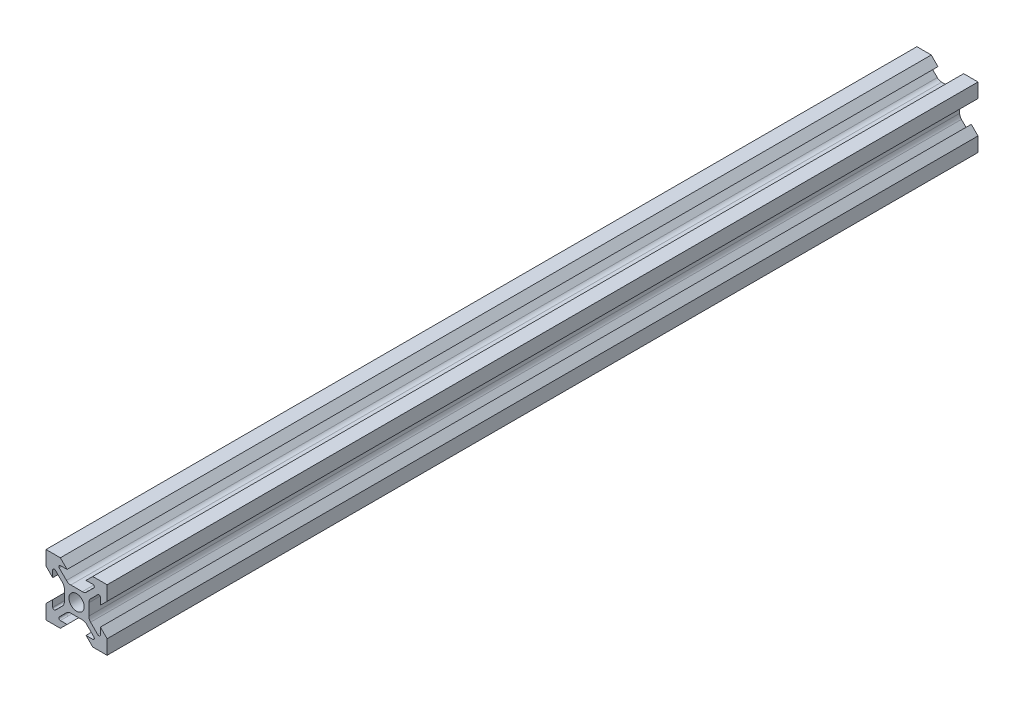
from build123d import *

# Parameters (mm, degrees)
SKETCH1_R           = 2.5
BOSS_EXTRUDE1_DEPTH = 285


with BuildPart() as part:
    # Sketch1 → Boss-Extrude1 (new body)
    with BuildSketch(Plane.XY):
        with BuildLine():
            Line((-10, 10), (-10, 5.3))
            Line((-10, 5.3), (-7.8, 3.1))
            Line((-7.8, 3.1), (-7.8, 5.320101013))
            ThreePointArc((-7.8, 5.320101013), (-7.491341716, 5.782040779), (-6.946446609, 5.673654403))
            Line((-6.946446609, 5.673654403), (-4.585786438, 3.312994231))
            ThreePointArc((-4.585786438, 3.312994231), (-4.152240935, 2.664147534), (-4, 1.898780669))
            Line((-4, 1.898780669), (-4, 0))
            Line((-4, 0), (-4, -1.898780669))
            ThreePointArc((-4, -1.898780669), (-4.152240935, -2.664147534), (-4.585786438, -3.312994231))
            Line((-4.585786438, -3.312994231), (-6.946446609, -5.673654403))
            ThreePointArc((-6.946446609, -5.673654403), (-7.491341716, -5.782040779), (-7.8, -5.320101013))
            Line((-7.8, -5.320101013), (-7.8, -3.1))
            Line((-7.8, -3.1), (-10, -5.3))
            Line((-10, -5.3), (-10, -10))
            Line((-10, -10), (-5.3, -10))
            Line((-5.3, -10), (-3.1, -7.8))
            Line((-3.1, -7.8), (-5.320101013, -7.8))
            ThreePointArc((-5.320101013, -7.8), (-5.782040779, -7.491341716), (-5.673654403, -6.946446609))
            Line((-5.673654403, -6.946446609), (-3.312994231, -4.585786438))
            ThreePointArc((-3.312994231, -4.585786438), (-2.664147534, -4.152240935), (-1.898780669, -4))
            Line((-1.898780669, -4), (0, -4))
            Line((0, -4), (1.898780669, -4))
            ThreePointArc((1.898780669, -4), (2.664147534, -4.152240935), (3.312994231, -4.585786438))
            Line((3.312994231, -4.585786438), (5.673654403, -6.946446609))
            ThreePointArc((5.673654403, -6.946446609), (5.782040779, -7.491341716), (5.320101013, -7.8))
            Line((5.320101013, -7.8), (3.1, -7.8))
            Line((3.1, -7.8), (5.3, -10))
            Line((5.3, -10), (10, -10))
            Line((10, -10), (10, -5.3))
            Line((10, -5.3), (7.8, -3.1))
            Line((7.8, -3.1), (7.8, -5.320101013))
            ThreePointArc((7.8, -5.320101013), (7.491341716, -5.782040779), (6.946446609, -5.673654403))
            Line((6.946446609, -5.673654403), (4.585786438, -3.312994231))
            ThreePointArc((4.585786438, -3.312994231), (4.152240935, -2.664147534), (4, -1.898780669))
            Line((4, -1.898780669), (4, 0))
            Line((4, 0), (4, 1.898780669))
            ThreePointArc((4, 1.898780669), (4.152240935, 2.664147534), (4.585786438, 3.312994231))
            Line((4.585786438, 3.312994231), (6.946446609, 5.673654403))
            ThreePointArc((6.946446609, 5.673654403), (7.491341716, 5.782040779), (7.8, 5.320101013))
            Line((7.8, 5.320101013), (7.8, 3.1))
            Line((7.8, 3.1), (10, 5.3))
            Line((10, 5.3), (10, 10))
            Line((10, 10), (5.3, 10))
            Line((5.3, 10), (3.1, 7.8))
            Line((3.1, 7.8), (5.320101013, 7.8))
            ThreePointArc((5.320101013, 7.8), (5.782040779, 7.491341716), (5.673654403, 6.946446609))
            Line((5.673654403, 6.946446609), (3.312994231, 4.585786438))
            ThreePointArc((3.312994231, 4.585786438), (2.664147534, 4.152240935), (1.898780669, 4))
            Line((1.898780669, 4), (0, 4))
            Line((0, 4), (-1.898780669, 4))
            ThreePointArc((-1.898780669, 4), (-2.664147534, 4.152240935), (-3.312994231, 4.585786438))
            Line((-3.312994231, 4.585786438), (-5.673654403, 6.946446609))
            ThreePointArc((-5.673654403, 6.946446609), (-5.782040779, 7.491341716), (-5.320101013, 7.8))
            Line((-5.320101013, 7.8), (-3.1, 7.8))
            Line((-3.1, 7.8), (-5.3, 10))
            Line((-5.3, 10), (-10, 10))
        make_face()
        Circle(SKETCH1_R, mode=Mode.SUBTRACT)
    extrude(amount=BOSS_EXTRUDE1_DEPTH)


solid = part.part
